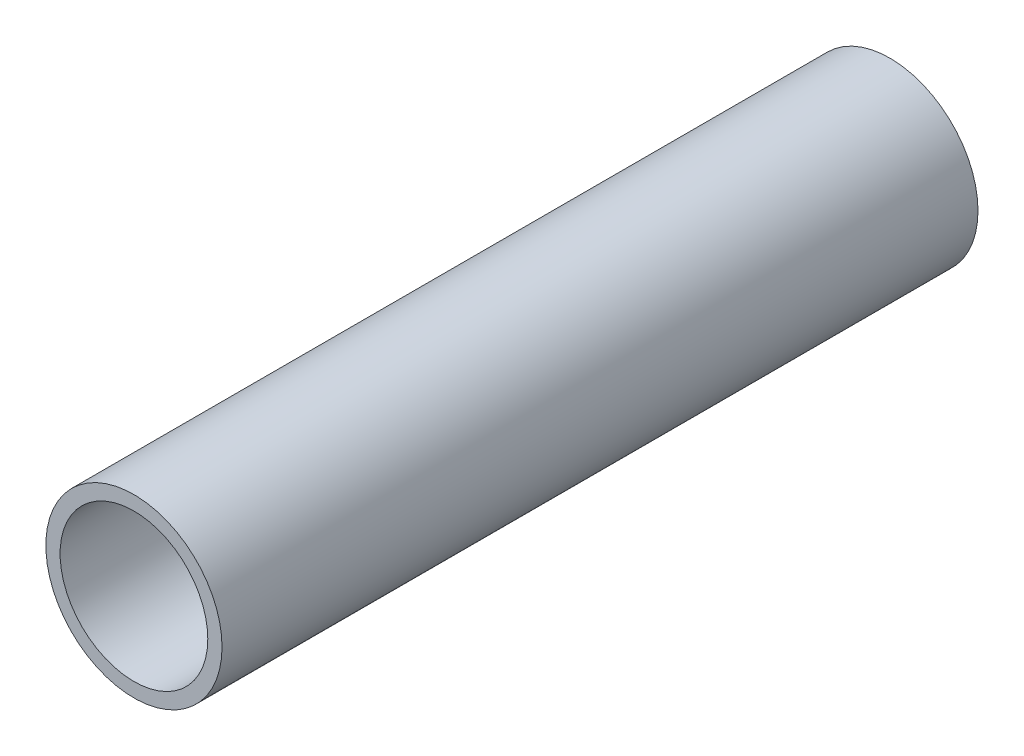
from build123d import *

# Parameters (mm, degrees)
SKETCH1_R           = 30.3
SKETCH1_R_2         = 25.4
BOSS_EXTRUDE1_DEPTH = 260


with BuildPart() as part:
    # Sketch1 → Boss-Extrude1 (new body)
    with BuildSketch(Plane.XY):
        Circle(SKETCH1_R)
        Circle(SKETCH1_R_2, mode=Mode.SUBTRACT)
    extrude(amount=BOSS_EXTRUDE1_DEPTH)


solid = part.part
